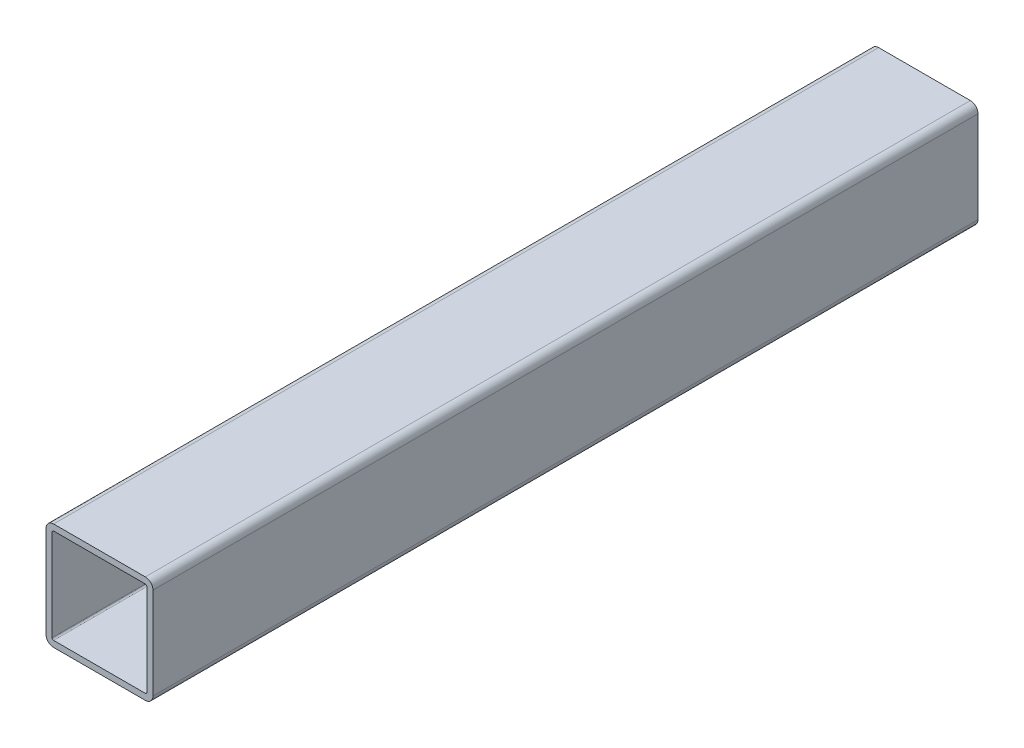
from build123d import *

# Parameters (mm, degrees)
BOSS_EXTRUDE1_DEPTH = 540


with BuildPart() as part:
    # Sketch1 → Boss-Extrude1 (new body)
    with BuildSketch(Plane.XY):
        with BuildLine():
            Line((5, 0), (65, 0))
            ThreePointArc((65, 0), (68.535533906, 1.464466094), (70, 5))
            Line((70, 5), (70, 65))
            ThreePointArc((70, 65), (68.535533906, 68.535533906), (65, 70))
            Line((65, 70), (5, 70))
            ThreePointArc((5, 70), (1.464466094, 68.535533906), (0, 65))
            Line((0, 65), (0, 5))
            ThreePointArc((0, 5), (1.464466094, 1.464466094), (5, 0))
        make_face()
        with BuildLine():
            Line((4, 5), (4, 65))
            ThreePointArc((4, 65), (4.292893219, 65.707106781), (5, 66))
            Line((5, 66), (65, 66))
            ThreePointArc((65, 66), (65.707106781, 65.707106781), (66, 65))
            Line((66, 65), (66, 5))
            ThreePointArc((66, 5), (65.707106781, 4.292893219), (65, 4))
            Line((65, 4), (5, 4))
            ThreePointArc((5, 4), (4.292893219, 4.292893219), (4, 5))
        make_face(mode=Mode.SUBTRACT)
    extrude(amount=BOSS_EXTRUDE1_DEPTH)


solid = part.part
